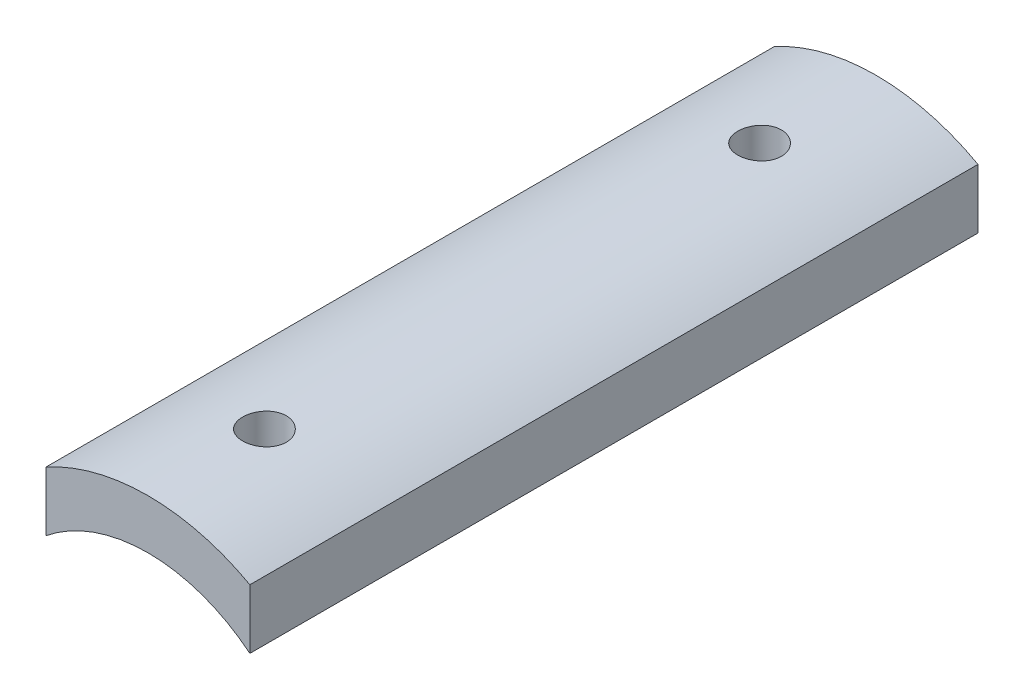
from build123d import *

# Parameters (mm, degrees)
BOSS_EXTRUDE1_DEPTH     = 50
CUT_EXTRUDE2_DEPTH      = 53.528563658
CUT_EXTRUDE2_DEPTH_BACK = 53.528563658
SKETCH7_R               = 1.5


with BuildPart() as part:
    # Sketch1 → Boss-Extrude1 (new body)
    with BuildSketch(Plane.XY):
        with BuildLine():
            Line((-7, 12.698425099), (-7, 8.614522622))
            ThreePointArc((-7, 8.614522622), (0, 11.1), (7, 8.614522622))
            Line((7, 8.614522622), (7, 12.698425099))
            ThreePointArc((7, 12.698425099), (0, 14.5), (-7, 12.698425099))
        make_face()
    extrude(amount=BOSS_EXTRUDE1_DEPTH)

    # Sketch7 → Cut-Extrude2 (cut, two sides: drawn at the far end of the back side and taken through both)
    with BuildSketch(Plane(origin=(0, 0, 0), x_dir=(1, 0, 0), z_dir=(0, 1, 0)).offset(-CUT_EXTRUDE2_DEPTH_BACK)):
        with Locations(Location((0, -8, 0), (0, 0, 90))):
            Circle(SKETCH7_R)
        with Locations(Location((0, -42, 0), (0, 0, 90))):
            Circle(SKETCH7_R)
    extrude(amount=CUT_EXTRUDE2_DEPTH + CUT_EXTRUDE2_DEPTH_BACK, mode=Mode.SUBTRACT)


solid = part.part
